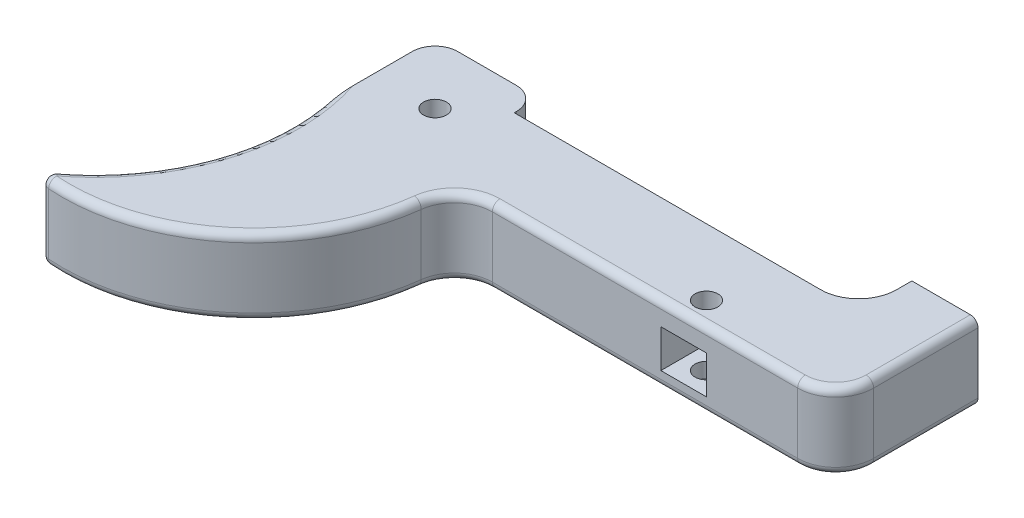
from build123d import *

# Parameters (mm, degrees)
CROQUIS1_R              = 1.5
SALIENTE_EXTRUIR1_DEPTH = 10
REDONDEO1_R             = 3
CROQUIS3_R              = 1.5
CORTAR_EXTRUIR2_DEPTH   = 11
REDONDEO2_R             = 5
CROQUIS4_W              = 6
CROQUIS4_H              = 5
CORTAR_EXTRUIR3_DEPTH   = 6
REDONDEO3_R             = 1


with BuildPart() as part:
    # Croquis1 → Saliente-Extruir1 (new body)
    with BuildSketch(Plane(origin=(0, 0, 0), x_dir=(1, 0, 0), z_dir=(0, 1, 0))):
        with BuildLine():
            Line((13.699946153, 11.735059562), (59.024625957, 11.735059562))
            Line((59.024625957, 11.735059562), (59.024625957, 18.735059562))
            Line((59.024625957, 18.735059562), (67.731133792, 18.735059562))
            Line((67.731133792, 18.735059562), (67.731133792, 0))
            Line((67.731133792, 0), (17.731133792, 0))
            ThreePointArc((17.731133792, 0), (9.262538254, -20.305782945), (-11.922145642, -26.243046592))
            ThreePointArc((-11.922145642, -26.243046592), (-1.979394551, -14.930389049), (0, 0))
            Line((0, 0), (0, 15))
            Line((0, 15), (13.699946153, 15))
            Line((13.699946153, 15), (13.699946153, 11.735059562))
        make_face()
        with Locations(Location((8, 7, 0), (0, 0, 270))):
            Circle(CROQUIS1_R, mode=Mode.SUBTRACT)
    extrude(amount=SALIENTE_EXTRUIR1_DEPTH)

    # Redondeo1
    redondeo1_edges = [part.edges().sort_by_distance(p)[0] for p in [
        (0, 5, -15),
        (13.699946153, 5, -15),
    ]]
    fillet(redondeo1_edges, radius=REDONDEO1_R)

    # Croquis3 → Cortar-Extruir2 (cut)
    with BuildSketch(Plane(origin=(0, 10, 0), x_dir=(1, 0, 0), z_dir=(0, 1, 0))):
        with Locations(Location((47.731133792, 3, 0), (0, 0, 270))):
            Circle(CROQUIS3_R)
    extrude(amount=-CORTAR_EXTRUIR2_DEPTH, mode=Mode.SUBTRACT)

    # Redondeo2
    redondeo2_edges = [part.edges().sort_by_distance(p)[0] for p in [
        (67.731133792, 5, 0),
        (17.731133792, 5, 0),
        (59.024625957, 5, -11.735059562),
    ]]
    fillet(redondeo2_edges, radius=REDONDEO2_R)

    # Croquis4 → Cortar-Extruir3 (cut)
    with BuildSketch(Plane.XY):
        with Locations((47.731133792, 4.5)):
            Rectangle(CROQUIS4_W, CROQUIS4_H)
    extrude(amount=-CORTAR_EXTRUIR3_DEPTH, mode=Mode.SUBTRACT)

    # Redondeo3
    redondeo3_edges = [part.edges().sort_by_distance(p)[0] for p in [
        (7.547710992, 0, 21.694525169),
        (-1.979394551, 0, 14.930389049),
        (-11.922145642, 5, 26.243046592),
        (0, 5, 0),
        (-1.979394551, 10, 14.930389049),
        (7.547710992, 10, 21.694525169),
        (67.731133792, 0, -11.867529781),
        (67.731133792, 10, -11.867529781),
        (42.644255321, 0, 0),
        (66.266667698, 0, -1.464466094),
        (42.644255321, 10, 0),
        (66.266667698, 10, -1.464466094),
        (19.238162868, 0, 1.260639287),
        (19.238162868, 10, 1.260639287),
    ]]
    fillet(redondeo3_edges, radius=REDONDEO3_R)


solid = part.part
